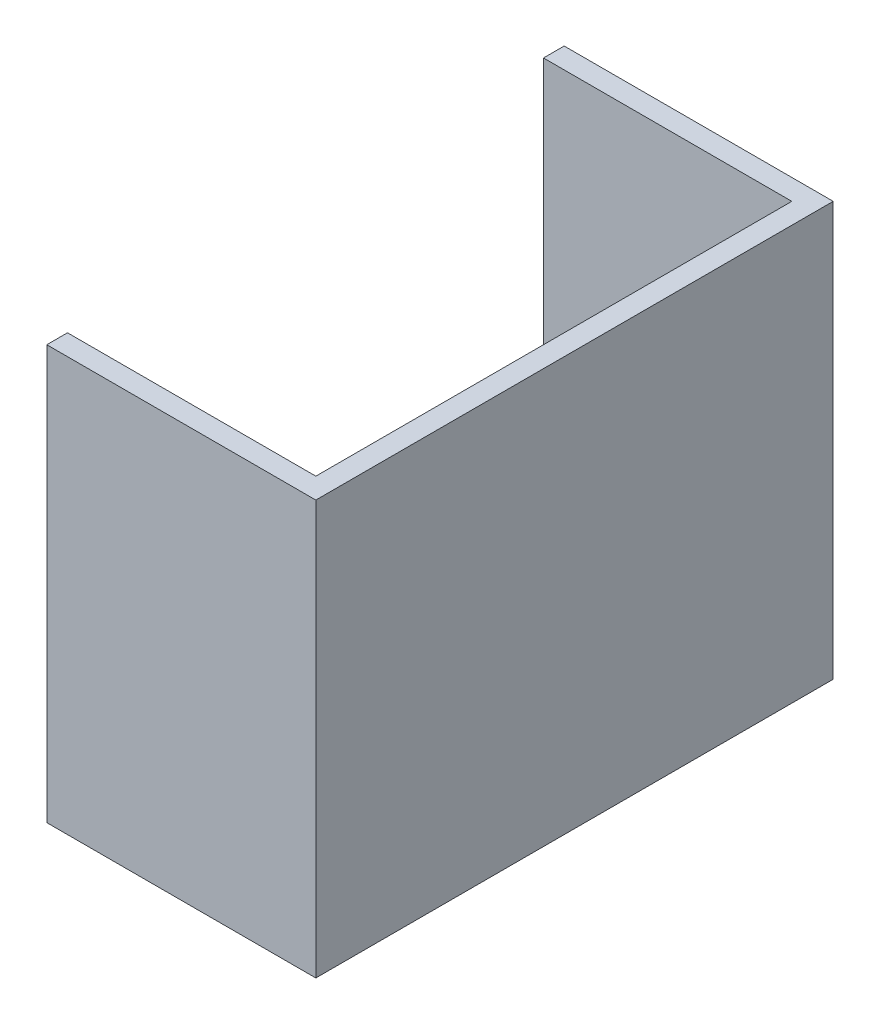
from build123d import *

# Parameters (mm, degrees)
SKETCH_15_W          = 13
SKETCH_15_H          = 25
EXTRUDE_4_DEPTH      = 20
CUT_EXTRUDE_START    = 1
SKETCH_16_W          = 12
SKETCH_16_H          = 23
CUT_EXTRUDE_47_DEPTH = 24.6018292
CUT_EXTRUDE_48_DEPTH = 25.6018292


with BuildPart() as part:
    # 스케치15 → 보스-돌출4 (new body)
    with BuildSketch(Plane(origin=(0, 0, 0), x_dir=(1, 0, 0), z_dir=(0, 1, 0))):
        with Locations((0.5, 0)):
            Rectangle(SKETCH_15_W, SKETCH_15_H)
    extrude(amount=EXTRUDE_4_DEPTH)

    # 스케치16 → 컷-돌출47 (cut, through all)
    with BuildSketch(Plane(origin=(0, 0, 0), x_dir=(1, 0, 0), z_dir=(0, 1, 0)).offset(CUT_EXTRUDE_START)):
        Rectangle(SKETCH_16_W, SKETCH_16_H)
    extrude(amount=CUT_EXTRUDE_47_DEPTH, mode=Mode.SUBTRACT)

    # 스케치17 → 컷-돌출48 (cut, through all)
    with BuildSketch(Plane(origin=(0, 0, 0), x_dir=(1, 0, 0), z_dir=(0, 1, 0))):
        with BuildLine():
            Line((-6, -3.5), (6, -3.5))
            Line((6, -3.5), (6, 5.5))
            ThreePointArc((6, 5.5), (0, 11.5), (-6, 5.5))
            Line((-6, 5.5), (-6, -3.5))
        make_face()
    extrude(amount=CUT_EXTRUDE_48_DEPTH, mode=Mode.SUBTRACT)


solid = part.part
